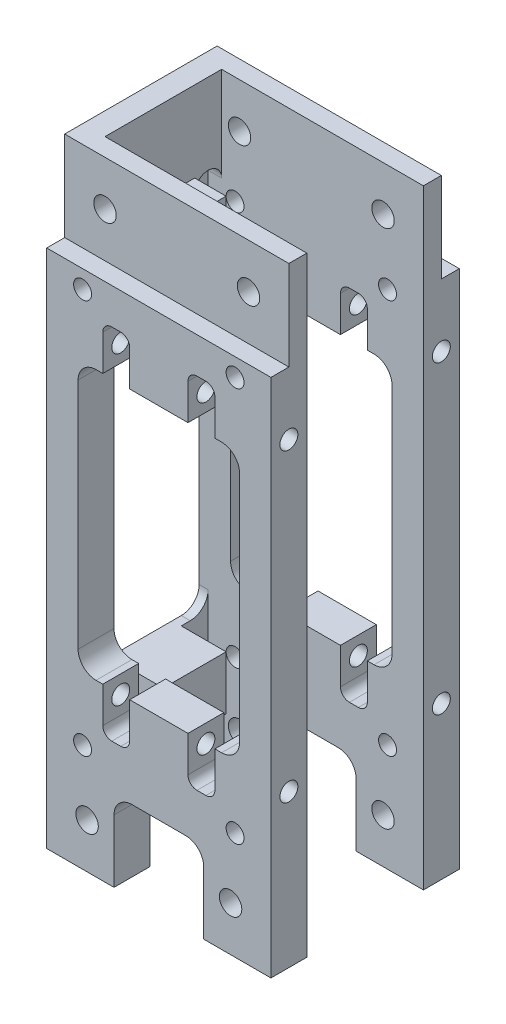
from build123d import *

# Parameters (mm, degrees)
SKETCH_1_W           = 25
SKETCH_1_H           = 21
EXTRUDE_2_DEPTH      = 34
SKETCH_2_W           = 10
SKETCH_2_H           = 9
SKETCH_2_R           = 1
CUT_EXTRUDE_4_DEPTH  = 60
SKETCH_3_R           = 1
SKETCH_3_W           = 13
SKETCH_3_H           = 38
CUT_EXTRUDE_2_DEPTH  = 44.488504228
SKETCH_6_W           = 3.5
SKETCH_6_H           = 7
CUT_EXTRUDE_5_DEPTH  = 9
SKETCH_11_W          = 3.5
SKETCH_11_H          = 7
CUT_EXTRUDE_9_DEPTH  = 9
SKETCH_7_R           = 1.25
CUT_EXTRUDE_6_DEPTH  = 42.871828238
SKETCH_9_W           = 25
SKETCH_9_H           = 10
CUT_EXTRUDE_7_DEPTH  = 2
SKETCH_10_W          = 25
SKETCH_10_H          = 10
CUT_EXTRUDE_8_DEPTH  = 2
CUT_EXTRUDE_START    = -6
SKETCH_12_W          = 13
SKETCH_12_H          = 68
CUT_EXTRUDE_10_DEPTH = 6
EXTRUDE_4_DEPTH      = 1.5
FILLET_R2_R          = 2
FILLET_R1_R          = 1


with BuildPart() as part:
    # 草图1 → 凸台-拉伸2 (new, symmetric)
    with BuildSketch(Plane(origin=(0, 0, 0), x_dir=(1, 0, 0), z_dir=(0, 1, 0))):
        Rectangle(SKETCH_1_W, SKETCH_1_H)
        Polygon((11.5, -3.5), (11.5, -6.5), (6.5, -6.5), (6, -6.5), (-6, -6.5), (-6.5, -6.5), (-11.5, -6.5), (-11.5, -3.5), (-6.5, -3.5), (-6.5, 3.5), (-11.5, 3.5), (-11.5, 6.5), (-6.5, 6.5), (-6, 6.5), (6, 6.5), (6.5, 6.5), (11.5, 6.5), (11.5, 3.5), (6.5, 3.5), (6.5, -3.5), align=None, mode=Mode.SUBTRACT)
    extrude(amount=EXTRUDE_2_DEPTH, both=True)

    # 草图2 → 切除-拉伸4 (cut)
    with BuildSketch(Plane(origin=(0, 0, -10.5), x_dir=(-1, 0, 0), z_dir=(0, 0, -1))):
        Polygon((9, -15), (9, 15), (6.25, 15), (6.25, 20), (3.25, 20), (3.25, 15), (-3.25, 15), (-3.25, 20), (-6.25, 20), (-6.25, 15), (-9, 15), (-9, -15), (-6.25, -15), (-6.25, -20), (-3.25, -20), (-3.25, -15), (3.25, -15), (3.25, -20), (6.25, -20), (6.25, -15), align=None)
        with Locations((0, -29.5)):
            Rectangle(SKETCH_2_W, SKETCH_2_H)
        with Locations((8.5, -22)):
            Circle(SKETCH_2_R)
        with Locations((-8.5, -22)):
            Circle(SKETCH_2_R)
        with Locations((-8.5, 22)):
            Circle(SKETCH_2_R)
        with Locations((8.5, 22)):
            Circle(SKETCH_2_R)
    extrude(amount=-CUT_EXTRUDE_4_DEPTH, mode=Mode.SUBTRACT)

    # 草图3 → 切除-拉伸2 (cut, through all)
    with BuildSketch(Plane(origin=(12.5, 0, 0), x_dir=(0, 0, -1), z_dir=(1, 0, 0))):
        with Locations((8.5, -17)):
            Circle(SKETCH_3_R)
        with Locations(Location((8.5, 17, 0), (0, 0, 180))):
            Circle(SKETCH_3_R)
        with Locations((-8.5, 17)):
            Circle(SKETCH_3_R)
        with Locations((-8.5, -17)):
            Circle(SKETCH_3_R)
        Rectangle(SKETCH_3_W, SKETCH_3_H)
    extrude(amount=-CUT_EXTRUDE_2_DEPTH, mode=Mode.SUBTRACT)

    # 草图6 → 切除-拉伸5 (cut)
    with BuildSketch(Plane.XZ.offset(34)):
        with Locations((8.25, 0)):
            Rectangle(SKETCH_6_W, SKETCH_6_H)
        with Locations((-8.25, 0)):
            Rectangle(SKETCH_6_W, SKETCH_6_H)
    extrude(amount=-CUT_EXTRUDE_5_DEPTH, mode=Mode.SUBTRACT)

    # 草图11 → 切除-拉伸9 (cut)
    with BuildSketch(Plane(origin=(0, 34, 0), x_dir=(1, 0, 0), z_dir=(0, 1, 0))):
        with Locations((-8.25, 0)):
            Rectangle(SKETCH_11_W, SKETCH_11_H)
        with Locations((8.25, 0)):
            Rectangle(SKETCH_11_W, SKETCH_11_H)
    extrude(amount=-CUT_EXTRUDE_9_DEPTH, mode=Mode.SUBTRACT)

    # 草图7 → 切除-拉伸6 (cut, through all)
    with BuildSketch(Plane(origin=(0, 0, -10.5), x_dir=(-1, 0, 0), z_dir=(0, 0, -1))):
        with Locations((8, -29)):
            Circle(SKETCH_7_R)
        with Locations(Location((-8, -29, 0), (0, 0, 180))):
            Circle(SKETCH_7_R)
        with Locations((-8, 29)):
            Circle(SKETCH_7_R)
        with Locations(Location((8, 29, 0), (0, 0, 180))):
            Circle(SKETCH_7_R)
    extrude(amount=-CUT_EXTRUDE_6_DEPTH, mode=Mode.SUBTRACT)

    # 草图9 → 切除-拉伸7 (cut)
    with BuildSketch(Plane(origin=(0, 0, -10.5), x_dir=(-1, 0, 0), z_dir=(0, 0, -1))):
        with Locations((0, 29)):
            Rectangle(SKETCH_9_W, SKETCH_9_H)
    extrude(amount=-CUT_EXTRUDE_7_DEPTH, mode=Mode.SUBTRACT)

    # 草图10 → 切除-拉伸8 (cut)
    with BuildSketch(Plane.XY.offset(10.5)):
        with Locations((0, 29)):
            Rectangle(SKETCH_10_W, SKETCH_10_H)
    extrude(amount=-CUT_EXTRUDE_8_DEPTH, mode=Mode.SUBTRACT)

    # 草图12 → 切除-拉伸10 (cut)
    with BuildSketch(Plane(origin=(12.5, 0, 0), x_dir=(0, 0, -1), z_dir=(1, 0, 0)).offset(CUT_EXTRUDE_START)):
        Rectangle(SKETCH_12_W, SKETCH_12_H)
    extrude(amount=CUT_EXTRUDE_10_DEPTH, mode=Mode.SUBTRACT)

    # 草图13 → 凸台-拉伸4 (add)
    with BuildSketch(Plane(origin=(-11.5, 0, 0), x_dir=(0, 0, -1), z_dir=(1, 0, 0))):
        with BuildLine():
            Line((-6.5, -34), (-3.5, -34))
            Line((-3.5, -34), (-3.5, -23.5))
            ThreePointArc((-3.5, -23.5), (-5, -25), (-6.5, -23.5))
            Line((-6.5, -23.5), (-6.5, -34))
        make_face()
        with BuildLine():
            Line((3.5, -34), (3.5, -23.5))
            ThreePointArc((3.5, -23.5), (5, -25), (6.5, -23.5))
            Line((6.5, -23.5), (6.5, -34))
            Line((6.5, -34), (3.5, -34))
        make_face()
        with BuildLine():
            Line((-3.5, 34), (-3.5, 23.5))
            ThreePointArc((-3.5, 23.5), (-5, 25), (-6.5, 23.5))
            Line((-6.5, 23.5), (-6.5, 34))
            Line((-6.5, 34), (-3.5, 34))
        make_face()
        with BuildLine():
            Line((6.5, 34), (6.5, 23.5))
            ThreePointArc((6.5, 23.5), (5, 25), (3.5, 23.5))
            Line((3.5, 23.5), (3.5, 34))
            Line((3.5, 34), (6.5, 34))
        make_face()
    extrude(amount=EXTRUDE_4_DEPTH)

    # R2
    fillet_r2_edges = [part.edges().sort_by_distance(p)[0] for p in [
        (5, -25, 8.5),
        (5, -25, -8.5),
        (-5, -25, 8.5),
        (-5, -25, -8.5),
        (9, -15, 8.5),
        (9, -15, -8.5),
        (9, 15, 8.5),
        (9, 15, -8.5),
        (-9, 15, 8.5),
        (-9, 15, -8.5),
        (-9, -15, 8.5),
        (-9, -15, -8.5),
        (-12, -19, 6.5),
        (-12, 19, -6.5),
        (-12, 19, 6.5),
        (-12, -19, -6.5),
    ]]
    fillet(fillet_r2_edges, radius=FILLET_R2_R)

    # R1
    fillet_r1_edges = [part.edges().sort_by_distance(p)[0] for p in [
        (-3.25, -20, 8.5),
        (-3.25, -20, -8.5),
        (-6.25, -20, 8.5),
        (-6.25, -20, -8.5),
        (3.25, -20, 8.5),
        (3.25, -20, -8.5),
        (6.25, -20, 8.5),
        (6.25, -20, -8.5),
        (6.25, 20, 8.5),
        (6.25, 20, -8.5),
        (3.25, 20, 8.5),
        (3.25, 20, -8.5),
        (-3.25, 20, 8.5),
        (-3.25, 20, -8.5),
        (-6.25, 20, 8.5),
        (-6.25, 20, -8.5),
    ]]
    fillet(fillet_r1_edges, radius=FILLET_R1_R)


solid = part.part
